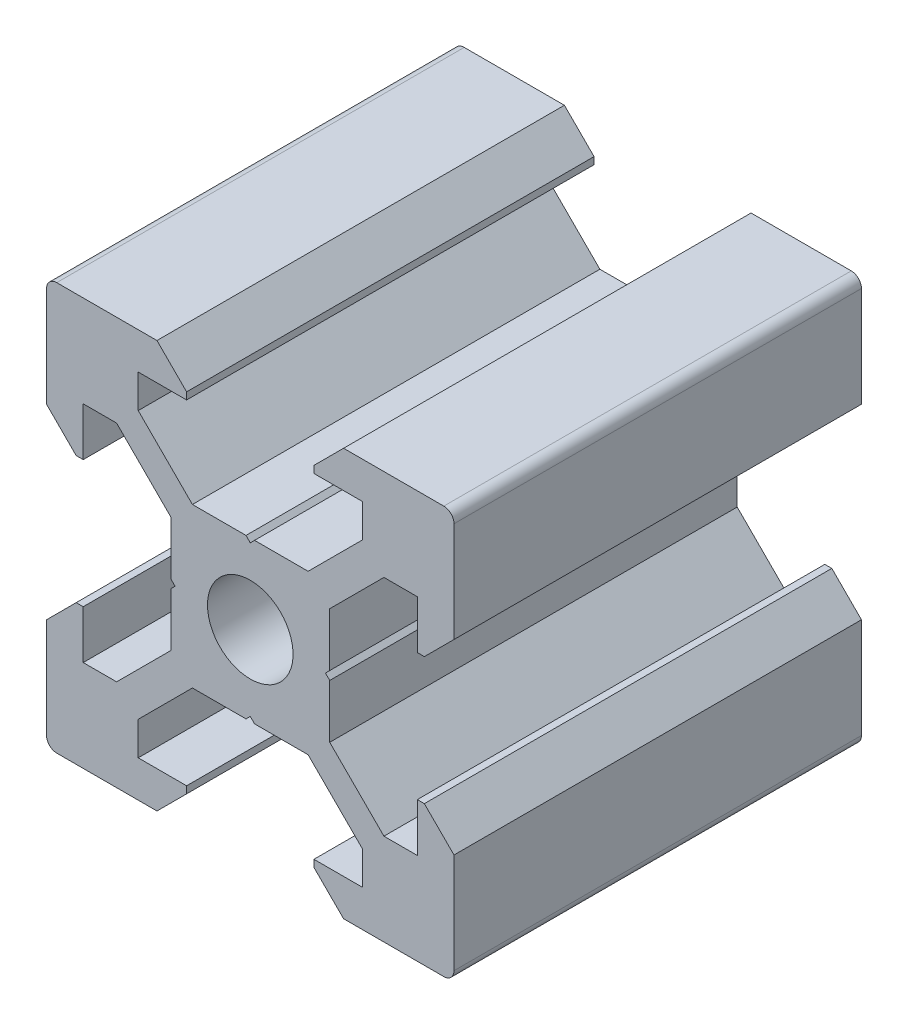
from build123d import *

# Parameters (mm, degrees)
BOSS_EXTRU_1_DEPTH           = 20
R_P_TITION_CIRCULAIRE1_COUNT = 4


with BuildPart() as part:
    # Esquisse1 → Boss.-Extru.1 (new body)
    with BuildSketch(Plane.XY):
        with BuildLine():
            Line((-9.5, 10), (-4.58, 10))
            Line((-4.58, 10), (-3.125, 8.545))
            Line((-3.125, 8.545), (-3.125, 8.2))
            Line((-3.125, 8.2), (-5.5, 8.2))
            Line((-5.5, 8.2), (-5.5, 6.560660172))
            Line((-5.5, 6.560660172), (-2.839339828, 3.9))
            Line((-2.839339828, 3.9), (-0.21, 3.9))
            Line((-0.21, 3.9), (0, 3.69))
            Line((0, 3.69), (0, 2.1))
            ThreePointArc((0, 2.1), (-1.48492424, 1.48492424), (-2.1, 0))
            Line((-2.1, 0), (-3.69, 0))
            Line((-3.69, 0), (-3.9, 0.21))
            Line((-3.9, 0.21), (-3.9, 2.839339828))
            Line((-3.9, 2.839339828), (-6.560660172, 5.5))
            Line((-6.560660172, 5.5), (-8.2, 5.5))
            Line((-8.2, 5.5), (-8.2, 3.125))
            Line((-8.2, 3.125), (-8.545, 3.125))
            Line((-8.545, 3.125), (-10, 4.58))
            Line((-10, 4.58), (-10, 9.5))
            ThreePointArc((-10, 9.5), (-9.853553391, 9.853553391), (-9.5, 10))
        make_face()
    boss_extru_1 = extrude(amount=BOSS_EXTRU_1_DEPTH)

    # Répétition circulaire1: Boss.-Extru.1 ×4 about axis
    r_p_tition_circulaire1_axis = Axis((0, 0, -13.782028156), (0, 0, 1))
    for i in range(1, R_P_TITION_CIRCULAIRE1_COUNT):
        add(boss_extru_1.rotate(r_p_tition_circulaire1_axis, i * 360 / R_P_TITION_CIRCULAIRE1_COUNT))


solid = part.part
